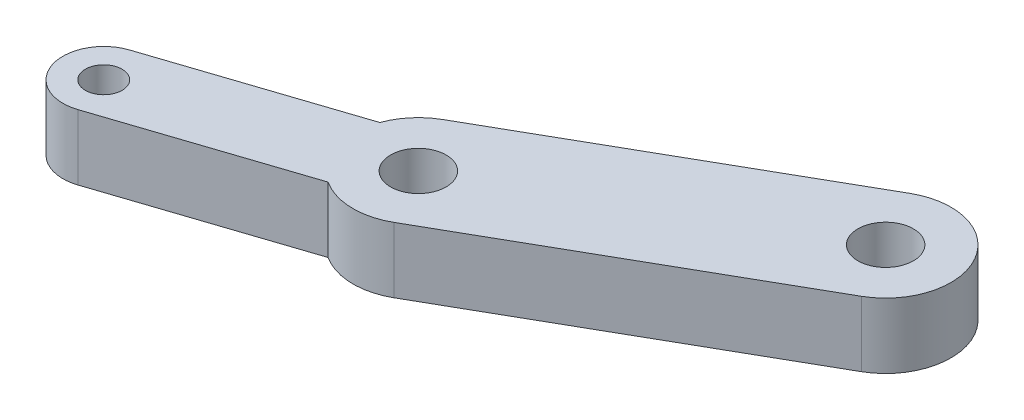
from build123d import *

# Parameters (mm, degrees)
SKETCH1_R           = 1.7
SKETCH1_R_2         = 1.125
BOSS_EXTRUDE1_DEPTH = 4


with BuildPart() as part:
    # Sketch1 → Boss-Extrude1 (new body)
    with BuildSketch(Plane(origin=(0, 0, 0), x_dir=(1, 0, 0), z_dir=(0, 1, 0))):
        with BuildLine():
            Line((0.574387415, 10.756298336), (12.079945336, 14.572498241))
            ThreePointArc((12.079945336, 14.572498241), (12.781068241, 15.771003636), (13.849671556, 16.657612607))
            Line((13.849671556, 16.657612607), (32.075718477, 27.048075983))
            ThreePointArc((32.075718477, 27.048075983), (37.531739758, 25.554144329), (36.037808103, 20.098123048))
            Line((36.037808103, 20.098123048), (17.811761182, 9.707659672))
            ThreePointArc((17.811761182, 9.707659672), (15.716202719, 9.184275647), (13.654034262, 9.826737601))
            Line((13.654034262, 9.826737601), (2.14847634, 6.010537696))
            ThreePointArc((2.14847634, 6.010537696), (-1.011448443, 7.596373553), (0.574387415, 10.756298336))
        make_face()
        with Locations(Location((15.830716369, 13.182636139, 0), (0, 0, 270))):
            Circle(SKETCH1_R, mode=Mode.SUBTRACT)
        with Locations(Location((1.361431878, 8.383418016, 0), (0, 0, 270))):
            Circle(SKETCH1_R_2, mode=Mode.SUBTRACT)
        with Locations(Location((34.05676329, 23.573099516, 0), (0, 0, 270))):
            Circle(SKETCH1_R, mode=Mode.SUBTRACT)
    extrude(amount=BOSS_EXTRUDE1_DEPTH)


solid = part.part
